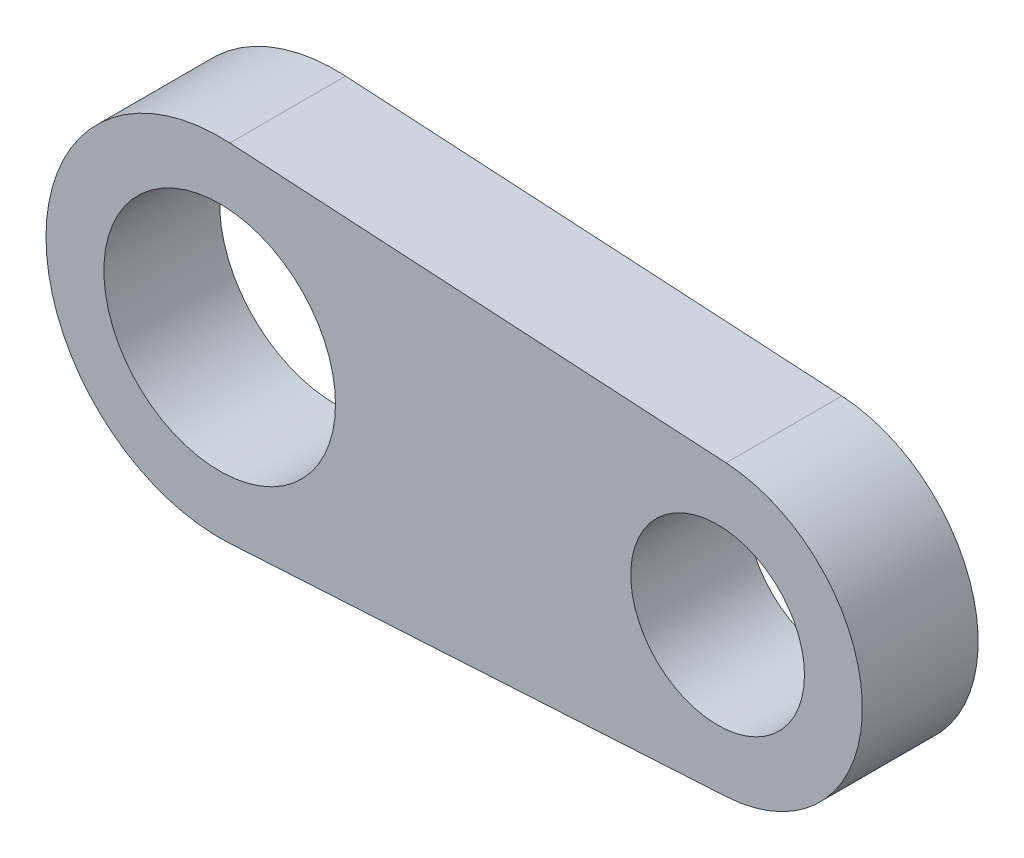
from build123d import *

# Parameters (mm, degrees)
BOSS_EXTRUDE1_DEPTH      = 5
BOSS_EXTRUDE1_DEPTH_BACK = 5
SKETCH1_R                = 10
SKETCH1_R_2              = 7.5


with BuildPart() as part:
    # Sketch1 → Boss-Extrude1 (new, two sides: drawn at the far end of the back side and taken through both)
    with BuildSketch(Plane.XY.offset(-BOSS_EXTRUDE1_DEPTH_BACK)):
        with BuildLine():
            Line((0.872093023, 14.974626999), (43.726744186, 12.478855832))
            ThreePointArc((43.726744186, 12.478855832), (55.5, 0), (43.726744186, -12.478855832))
            Line((43.726744186, -12.478855832), (0.872093023, -14.974626999))
            ThreePointArc((0.872093023, -14.974626999), (-15, 0), (0.872093023, 14.974626999))
        make_face()
        Circle(SKETCH1_R, mode=Mode.SUBTRACT)
        with Locations((43, 0)):
            Circle(SKETCH1_R_2, mode=Mode.SUBTRACT)
    extrude(amount=BOSS_EXTRUDE1_DEPTH + BOSS_EXTRUDE1_DEPTH_BACK)


solid = part.part
